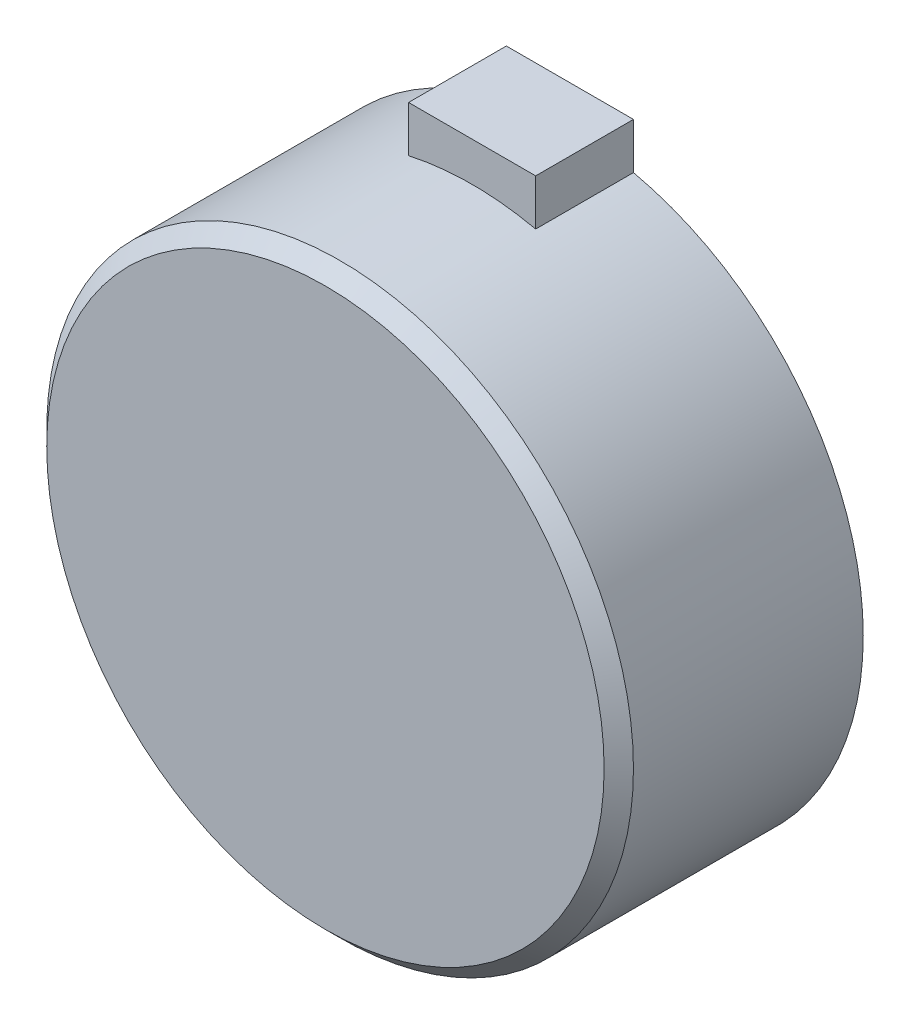
from build123d import *

# Parameters (mm, degrees)
SK_REARHOLE_R           = 2.1
REAR_TAPPED_HOLE_DEPTH  = 8
REAR_HOLE_PATTERN_COUNT = 8
SK_CONNECTOR_W          = 26
SK_CONNECTOR_H          = 12
CONNECTOR_ZONE_DEPTH    = 20


with BuildPart() as part:
    # SK_Body → Housing_Body (revolve)
    with BuildSketch(Plane(origin=(0, 0, 0), x_dir=(1, 0, 0), z_dir=(0, 1, 0))):
        Polygon((0, 0), (57, 0), (60, 3), (60, 50), (57, 50), (0, 50), align=None)
    revolve(axis=Axis((0, 0, 10), (0, 0, -1)))

    # SK_RearHole → Rear_Tapped_Hole (cut)
    with BuildSketch(Plane.XY.offset(-50)):
        with Locations((50, 0)):
            Circle(SK_REARHOLE_R)
    rear_tapped_hole = extrude(amount=REAR_TAPPED_HOLE_DEPTH, mode=Mode.SUBTRACT)

    # Rear_Hole_Pattern: Rear_Tapped_Hole ×8 about axis
    rear_hole_pattern_axis = Axis((0, 0, -52.5), (0, 0, 1))
    for i in range(1, REAR_HOLE_PATTERN_COUNT):
        add(rear_tapped_hole.rotate(rear_hole_pattern_axis, i * 360 / REAR_HOLE_PATTERN_COUNT), mode=Mode.SUBTRACT)

    # SK_Connector → Connector_Zone (add)
    with BuildSketch(Plane.XY.offset(-50)):
        with Locations((0, 62)):
            Rectangle(SK_CONNECTOR_W, SK_CONNECTOR_H)
    extrude(amount=CONNECTOR_ZONE_DEPTH)


solid = part.part
